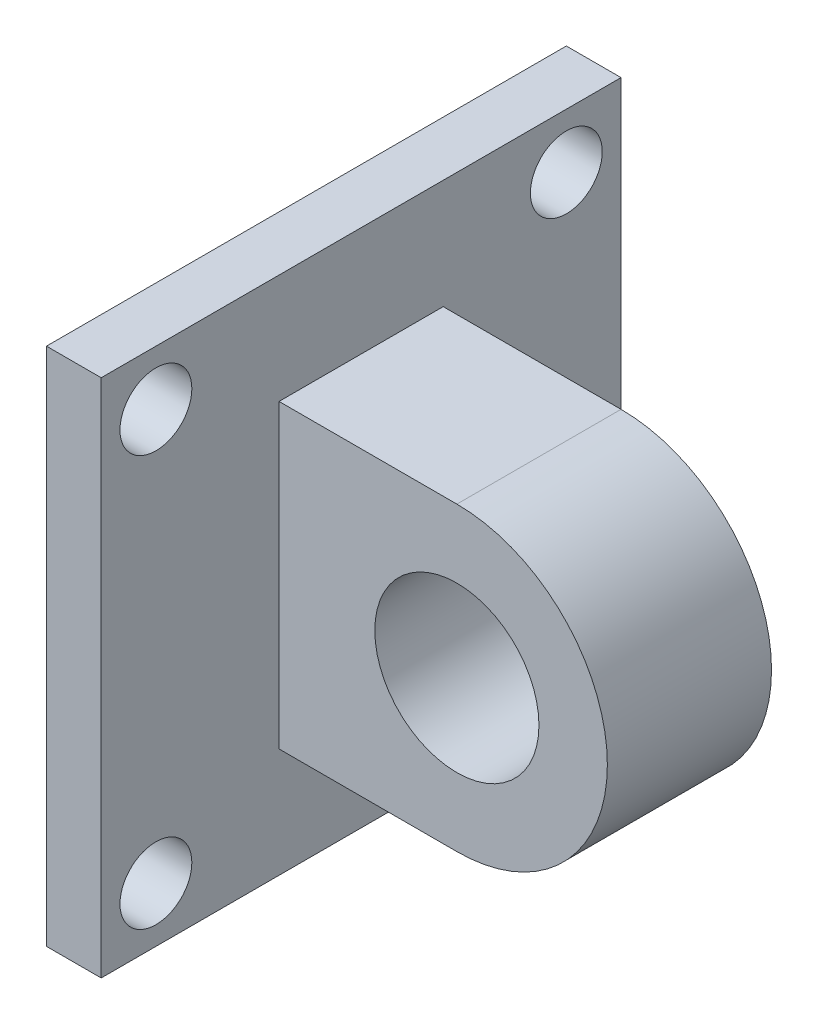
from build123d import *

# Parameters (mm, degrees)
SKETCH1_W           = 241.3
SKETCH1_H           = 241.3
BOSS_EXTRUDE1_DEPTH = 25.4
BOSS_EXTRUDE2_DEPTH = 76.2
HOLE1_D             = 76.2
HOLE1_DEPTH         = 158.75
HOLE2_D             = 33.3502
HOLE2_DEPTH         = 177.8


with BuildPart() as part:
    # Sketch1 → Boss-Extrude1 (new body)
    with BuildSketch(Plane(origin=(25.4, 0, 0), x_dir=(0, 0, -1), z_dir=(1, 0, 0))):
        Rectangle(SKETCH1_W, SKETCH1_H)
    extrude(amount=-BOSS_EXTRUDE1_DEPTH)

    # Sketch2 → Boss-Extrude2 (add)
    with BuildSketch(Plane.XY.offset(38.1)):
        with BuildLine():
            Line((25.4, 69.85), (25.4, -69.85))
            Line((25.4, -69.85), (107.95, -69.85))
            ThreePointArc((107.95, -69.85), (177.8, 0), (107.95, 69.85))
            Line((107.95, 69.85), (25.4, 69.85))
        make_face()
    extrude(amount=-BOSS_EXTRUDE2_DEPTH)

    # Hole1
    with Locations(Plane(origin=(0, 0, -38.1), x_dir=(-1, 0, 0), z_dir=(0, 0, -1))):
        with Locations((-107.95, 0)):
            Hole(HOLE1_D / 2, depth=HOLE1_DEPTH)

    # Hole2
    with Locations(Plane.ZY):
        with Locations((-95.25, -95.25), (-95.25, 95.25), (95.25, -95.25), (95.25, 95.25)):
            Hole(HOLE2_D / 2, depth=HOLE2_DEPTH)


solid = part.part
